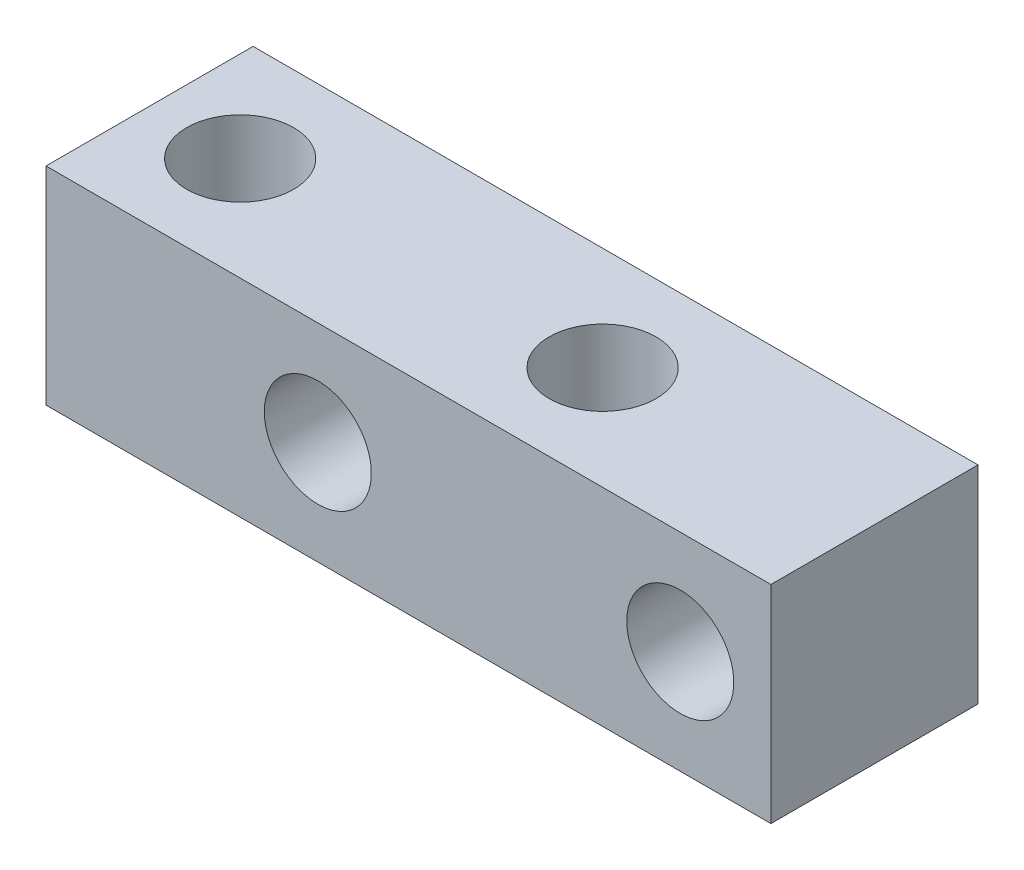
from build123d import *

# Parameters (mm, degrees)
SKETCH_1_W          = 21
SKETCH_1_H          = 6
EXTRUDE_1_DEPTH     = 6
SKETCH_2_R          = 1.55
CUT_EXTRUDE_1_DEPTH = 6
SKETCH_3_R          = 1.55
CUT_EXTRUDE_2_DEPTH = 6


with BuildPart() as part:
    # 草图1 → 凸台-拉伸1 (new body)
    with BuildSketch(Plane(origin=(0, 0, 0), x_dir=(1, 0, 0), z_dir=(0, 1, 0))):
        Rectangle(SKETCH_1_W, SKETCH_1_H)
    extrude(amount=EXTRUDE_1_DEPTH)

    # 草图2 → 切除-拉伸1 (cut)
    with BuildSketch(Plane(origin=(0, 0, -3), x_dir=(-1, 0, 0), z_dir=(0, 0, -1))):
        with Locations((-7.875, 3)):
            Circle(SKETCH_2_R)
        with Locations((2.625, 3)):
            Circle(SKETCH_2_R)
    extrude(amount=-CUT_EXTRUDE_1_DEPTH, mode=Mode.SUBTRACT)

    # 草图3 → 切除-拉伸2 (cut)
    with BuildSketch(Plane.XZ):
        with Locations(Location((-7.875, 0, 0), (0, 0, 270))):
            Circle(SKETCH_3_R)
        with Locations(Location((2.625, 0, 0), (0, 0, 270))):
            Circle(SKETCH_3_R)
    extrude(amount=-CUT_EXTRUDE_2_DEPTH, mode=Mode.SUBTRACT)


solid = part.part
